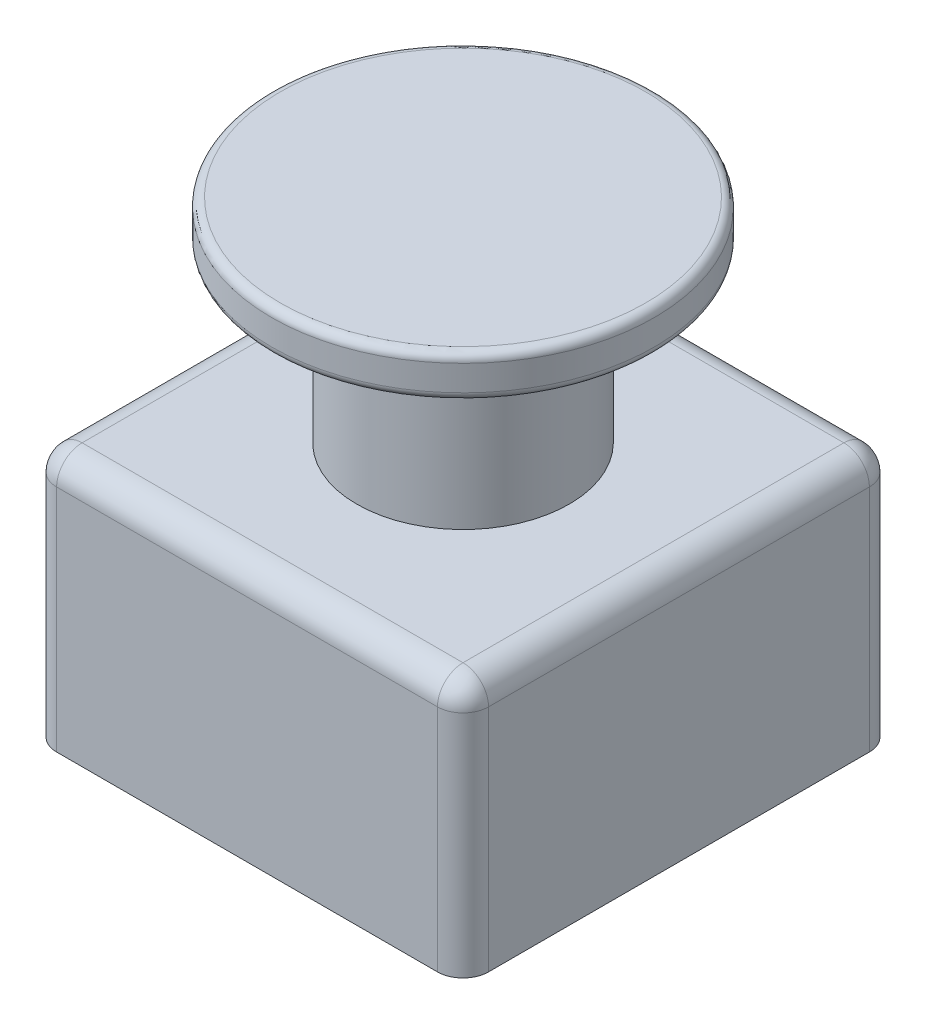
from build123d import *

# Parameters (mm, degrees)
SKETCH1_W           = 50.8
SKETCH1_H           = 50.8
BOSS_EXTRUDE1_DEPTH = 30
SKETCH2_R           = 12.5
BOSS_EXTRUDE2_DEPTH = 20
BOSS_EXTRUDE3_START = 20
SKETCH3_R           = 22.5
BOSS_EXTRUDE3_DEPTH = 5
FILLET1_R           = 3
FILLET2_R           = 1


with BuildPart() as part:
    # Sketch1 → Boss-Extrude1 (new body)
    with BuildSketch(Plane(origin=(0, 0, 0), x_dir=(1, 0, 0), z_dir=(0, 1, 0))):
        Rectangle(SKETCH1_W, SKETCH1_H)
    extrude(amount=-BOSS_EXTRUDE1_DEPTH)

    # Sketch2 → Boss-Extrude2 (add)
    with BuildSketch(Plane(origin=(0, 0, 0), x_dir=(1, 0, 0), z_dir=(0, 1, 0))):
        with Locations(Location((0, 0, 0), (0, 0, 270))):
            Circle(SKETCH2_R)
    extrude(amount=BOSS_EXTRUDE2_DEPTH)

    # Sketch3 → Boss-Extrude3 (add)
    with BuildSketch(Plane(origin=(0, 0, 0), x_dir=(1, 0, 0), z_dir=(0, 1, 0)).offset(BOSS_EXTRUDE3_START)):
        with Locations(Location((0, 0, 0), (0, 0, 270))):
            Circle(SKETCH3_R)
    extrude(amount=BOSS_EXTRUDE3_DEPTH)

    # Fillet1
    fillet1_edges = [part.edges().sort_by_distance(p)[0] for p in [
        (0, 0, 25.4),
        (-25.4, 0, 0),
        (0, 0, -25.4),
        (25.4, 0, 0),
        (25.4, -15, 25.4),
        (-25.4, -15, 25.4),
        (-25.4, -15, -25.4),
        (25.4, -15, -25.4),
    ]]
    fillet(fillet1_edges, radius=FILLET1_R)

    # Fillet2
    fillet2_edges = [part.edges().sort_by_distance(p)[0] for p in [
        (0, 20, -22.5),
        (0, 25, -22.5),
    ]]
    fillet(fillet2_edges, radius=FILLET2_R)


solid = part.part
